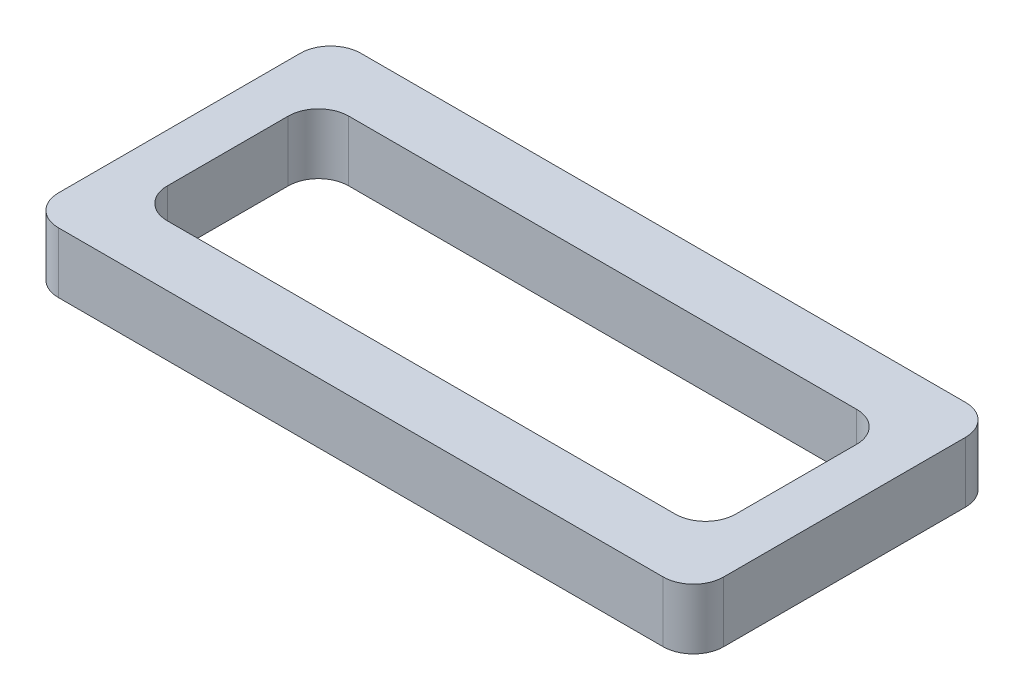
from build123d import *

# Parameters (mm, degrees)
SKETCH1_W           = 110
SKETCH1_H           = 50
SKETCH1_W_2         = 94
SKETCH1_H_2         = 30
BOSS_EXTRUDE1_DEPTH = 10
FILLET1_R           = 5


with BuildPart() as part:
    # Sketch1 → Boss-Extrude1 (new body)
    with BuildSketch(Plane(origin=(0, 0, 0), x_dir=(1, 0, 0), z_dir=(0, 1, 0))):
        Rectangle(SKETCH1_W, SKETCH1_H)
        Rectangle(SKETCH1_W_2, SKETCH1_H_2, mode=Mode.SUBTRACT)
    extrude(amount=BOSS_EXTRUDE1_DEPTH)

    # Fillet1
    fillet1_edges = [part.edges().sort_by_distance(p)[0] for p in [
        (-47, 5, -15),
        (-47, 5, 15),
        (47, 5, 15),
        (47, 5, -15),
        (-55, 5, 25),
        (-55, 5, -25),
        (55, 5, -25),
        (55, 5, 25),
    ]]
    fillet(fillet1_edges, radius=FILLET1_R)


solid = part.part
